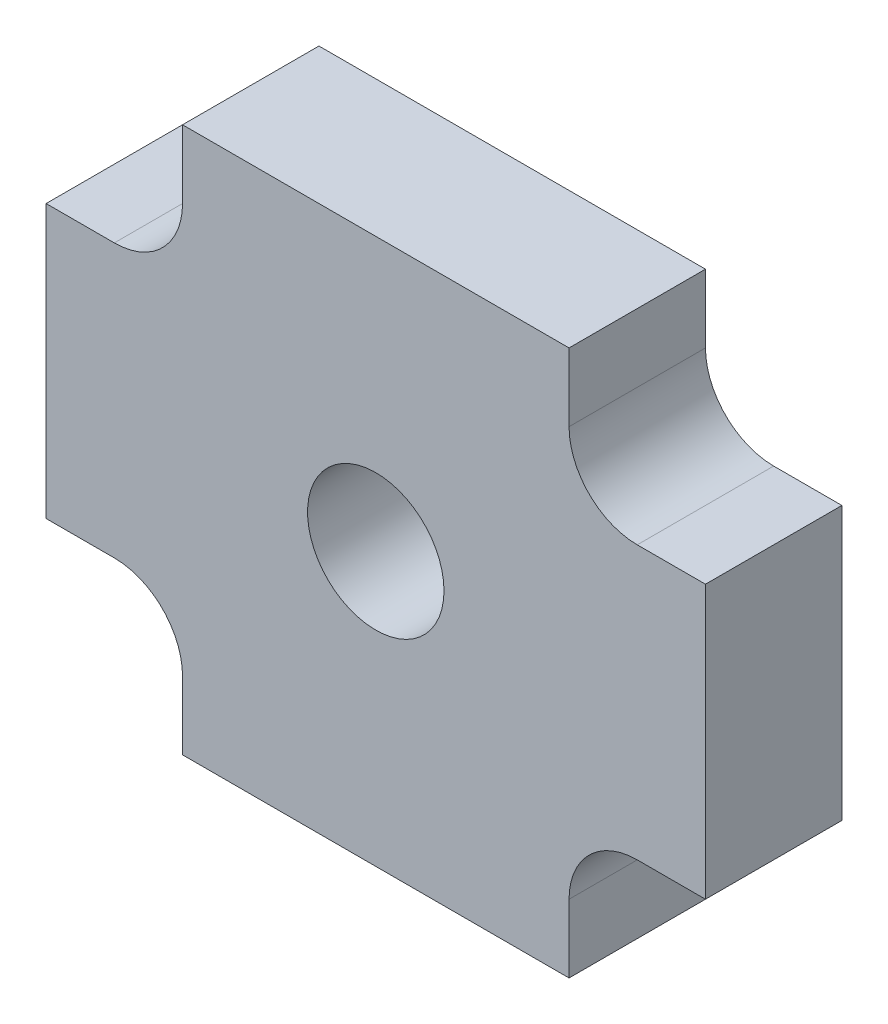
from build123d import *

# Parameters (mm, degrees)
MODEL_R                 = 1.5
SALIENTE_EXTRUIR1_DEPTH = 3


with BuildPart() as part:
    # Model → Saliente-Extruir1 (new body)
    with BuildSketch(Plane.XY):
        with BuildLine():
            Line((132.104752837, 242.341546665), (132.104752837, 236.341546665))
            Line((132.104752837, 236.341546665), (133.604752837, 236.341546665))
            ThreePointArc((133.604752837, 236.341546665), (134.665413008, 235.902206837), (135.104752837, 234.841546665))
            Line((135.104752837, 234.841546665), (135.104752837, 233.341546665))
            Line((135.104752837, 233.341546665), (143.604752837, 233.341546665))
            Line((143.604752837, 233.341546665), (143.604752837, 234.841546665))
            ThreePointArc((143.604752837, 234.841546665), (144.044092665, 235.902206837), (145.104752837, 236.341546665))
            Line((145.104752837, 236.341546665), (146.604752837, 236.341546665))
            Line((146.604752837, 236.341546665), (146.604752837, 242.341546665))
            Line((146.604752837, 242.341546665), (145.104752837, 242.341546665))
            ThreePointArc((145.104752837, 242.341546665), (144.044092665, 242.780886493), (143.604752837, 243.841546665))
            Line((143.604752837, 243.841546665), (143.604752837, 245.341546665))
            Line((143.604752837, 245.341546665), (135.104752837, 245.341546665))
            Line((135.104752837, 245.341546665), (135.104752837, 243.841546665))
            ThreePointArc((135.104752837, 243.841546665), (134.665413008, 242.780886493), (133.604752837, 242.341546665))
            Line((133.604752837, 242.341546665), (132.104752837, 242.341546665))
        make_face()
        with Locations((139.354752837, 239.341546665)):
            Circle(MODEL_R, mode=Mode.SUBTRACT)
    extrude(amount=SALIENTE_EXTRUIR1_DEPTH)


solid = part.part
